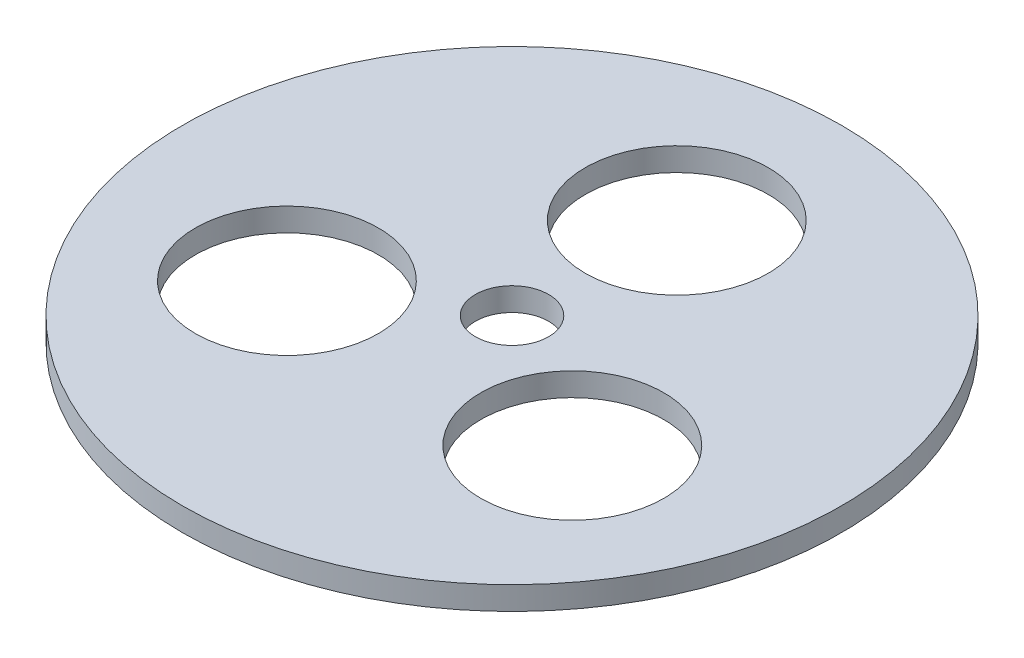
from build123d import *

# Parameters (mm, degrees)
SKETCH1_R           = 45
SKETCH1_R_2         = 12.5
BOSS_EXTRUDE1_DEPTH = 3.175
SKETCH3_R           = 5
CUT_EXTRUDE1_DEPTH  = 6.35


with BuildPart() as part:
    # Sketch1 → Boss-Extrude1 (new body)
    with BuildSketch(Plane(origin=(0, 0, 0), x_dir=(1, 0, 0), z_dir=(0, 1, 0))):
        with Locations(Location((0, 0, 0), (0, 0, 270))):
            Circle(SKETCH1_R)
        with Locations(Location((0, 22.5, 0), (0, 0, 270))):
            Circle(SKETCH1_R_2, mode=Mode.SUBTRACT)
        with Locations(Location((19.485571585, -11.25, 0), (0, 0, 270))):
            Circle(SKETCH1_R_2, mode=Mode.SUBTRACT)
        with Locations(Location((-19.485571585, -11.25, 0), (0, 0, 270))):
            Circle(SKETCH1_R_2, mode=Mode.SUBTRACT)
    extrude(amount=BOSS_EXTRUDE1_DEPTH)

    # Sketch3 → Cut-Extrude1 (cut)
    with BuildSketch(Plane(origin=(0, 3.175, 0), x_dir=(1, 0, 0), z_dir=(0, 1, 0))):
        with Locations(Location((0, 0, 0), (0, 0, 270))):
            Circle(SKETCH3_R)
    extrude(amount=-CUT_EXTRUDE1_DEPTH, mode=Mode.SUBTRACT)


solid = part.part
